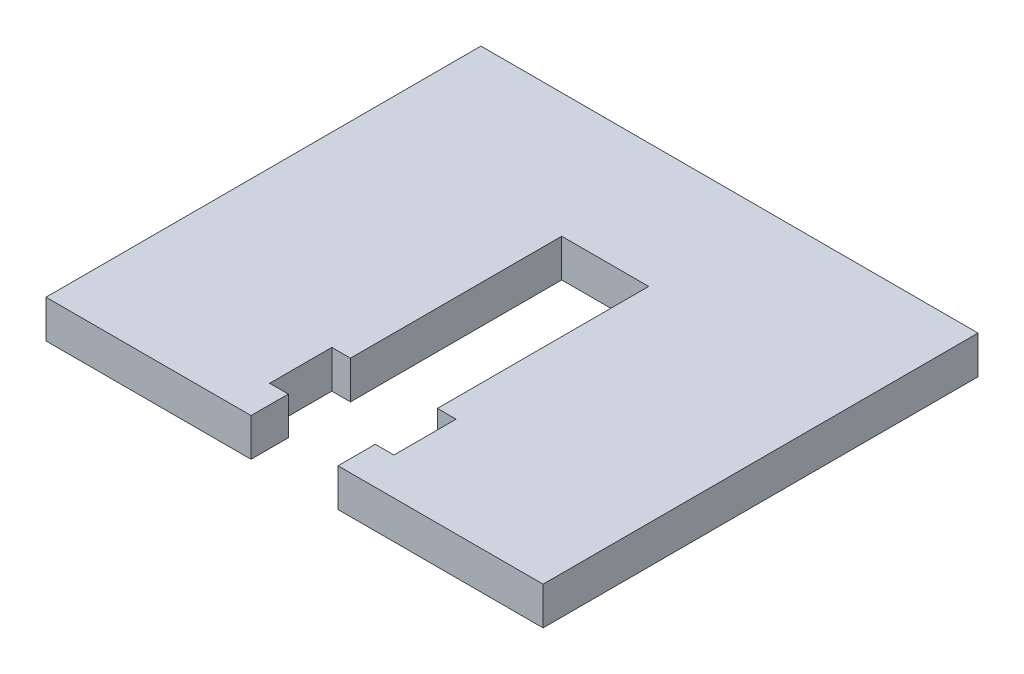
from build123d import *

# Parameters (mm, degrees)
BOSS_EXTRUDE1_DEPTH = 3.05


with BuildPart() as part:
    # Sketch1 → Boss-Extrude1 (new body)
    with BuildSketch(Plane(origin=(0, 0, 0), x_dir=(1, 0, 0), z_dir=(0, 1, 0))):
        Polygon((0, 0), (0, 35), (40, 35), (40, 0), (23.5, 0), (23.5, 3), (25, 3), (25, 8), (23.5, 8), (23.5, 25), (16.5, 25), (16.5, 8), (15, 8), (15, 3), (16.5, 3), (16.5, 0), align=None)
    extrude(amount=BOSS_EXTRUDE1_DEPTH)


solid = part.part
